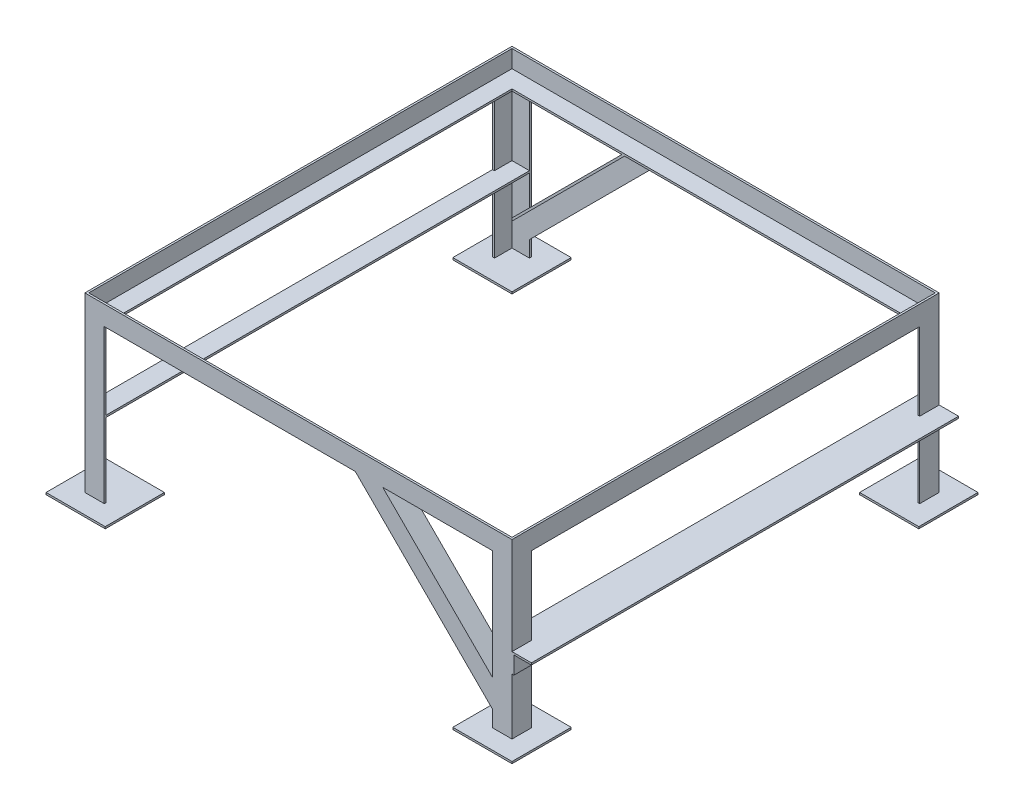
from build123d import *

# Parameters (mm, degrees)
SKETCH_1_W       = 1100
SKETCH_1_H       = 1100
SKETCH_1_W_2     = 1000
SKETCH_1_H_2     = 1000
EXTRUDE_1_DEPTH  = 5
SKETCH_2_W       = 1100
SKETCH_2_H       = 1100
SKETCH_2_W_2     = 1090
SKETCH_2_H_2     = 1090
EXTRUDE_2_DEPTH  = 45
EXTRUDE_3_DEPTH  = 400
SKETCH_4_W       = 152.5
SKETCH_4_H       = 152.5
EXTRUDE_4_DEPTH  = 5
EXTRUDE_6_REACH  = 1355.154
EXTRUDE_7_DEPTH  = 5
EXTRUDE_8_DEPTH  = 45
EXTRUDE_9_DEPTH  = 5
EXTRUDE_10_DEPTH = 45
EXTRUDE_11_DEPTH = 1100


with BuildPart() as part:
    # Эскиз1 → Бобышка-Вытянуть1 (new body)
    with BuildSketch(Plane(origin=(0, 0, 0), x_dir=(1, 0, 0), z_dir=(0, 1, 0))):
        Rectangle(SKETCH_1_W, SKETCH_1_H)
        Rectangle(SKETCH_1_W_2, SKETCH_1_H_2, mode=Mode.SUBTRACT)
    extrude(amount=EXTRUDE_1_DEPTH)

    # Эскиз2 → Бобышка-Вытянуть2 (add)
    with BuildSketch(Plane.XZ.offset(-5)):
        Rectangle(SKETCH_2_W, SKETCH_2_H)
        Rectangle(SKETCH_2_W_2, SKETCH_2_H_2, mode=Mode.SUBTRACT)
    extrude(amount=-EXTRUDE_2_DEPTH)

    # Эскиз3 → Бобышка-Вытянуть3 (add)
    with BuildSketch(Plane.XZ):
        Polygon((550, 550), (500, 550), (500, 545), (545, 545), (545, 500), (550, 500), align=None)
        Polygon((545, -500), (545, -545), (500, -545), (500, -550), (550, -550), (550, -500), align=None)
        Polygon((-550, -550), (-500, -550), (-500, -545), (-545, -545), (-545, -500), (-550, -500), align=None)
        Polygon((-545, 500), (-545, 545), (-500, 545), (-500, 550), (-550, 550), (-550, 500), align=None)
    extrude(amount=EXTRUDE_3_DEPTH)

    # Эскиз4 → Бобышка-Вытянуть4 (add)
    with BuildSketch(Plane.XZ.offset(400)):
        with Locations((523.75, 523.75)):
            Rectangle(SKETCH_4_W, SKETCH_4_H)
        with Locations((523.75, -523.75)):
            Rectangle(SKETCH_4_W, SKETCH_4_H)
        with Locations((-523.75, -523.75)):
            Rectangle(SKETCH_4_W, SKETCH_4_H)
        with Locations((-523.75, 523.75)):
            Rectangle(SKETCH_4_W, SKETCH_4_H)
    extrude(amount=-EXTRUDE_4_DEPTH)

    # Бобышка-Вытянуть6: up to this face of the body (flat: up to its plane)
    extrude_6_end = Plane(part.part.faces().sort_by_distance((522.5, -197.5, 545))[0])
    # Эскиз6 → Бобышка-Вытянуть6 (add, up to the picked face)
    with BuildSketch(Plane.XY.offset(-545), mode=Mode.PRIVATE) as extrude_6_sk1:
        Polygon((500, -200), (550, -200), (550, -250), (545, -250), (545, -205), (500, -205), align=None)
    extrude_6_tool1 = split(extrude(extrude_6_sk1.sketch, amount=EXTRUDE_6_REACH, mode=Mode.PRIVATE), bisect_by=extrude_6_end, keep=Keep.BOTH, mode=Mode.PRIVATE)
    # Эскиз6 → Бобышка-Вытянуть6 (add, up to the picked face)
    with BuildSketch(Plane.XY.offset(-545), mode=Mode.PRIVATE) as extrude_6_sk2:
        Polygon((-545, -250), (-545, -205), (-500, -205), (-500, -200), (-550, -200), (-550, -250), align=None)
    extrude_6_tool2 = split(extrude(extrude_6_sk2.sketch, amount=EXTRUDE_6_REACH, mode=Mode.PRIVATE), bisect_by=extrude_6_end, keep=Keep.BOTH, mode=Mode.PRIVATE)
    add(extrude_6_tool1.solids().sort_by(Axis((525, -200.707107, -545), (0, 0, 1)))[0])
    add(extrude_6_tool2.solids().sort_by(Axis((-545.707107, -227.5, -545), (0, 0, 1)))[0])

    # Эскиз7 → Бобышка-Вытянуть7 (add)
    with BuildSketch(Plane.XY.offset(550)):
        Polygon((146.446609407, 0), (217.157287525, 0), (500, -282.842712475), (500, -353.553390593), align=None)
    extrude(amount=-EXTRUDE_7_DEPTH)

    # Эскиз8 → Бобышка-Вытянуть8 (add)
    with BuildSketch(Plane(origin=(0, 0, 545), x_dir=(-1, 0, 0), z_dir=(0, 0, -1))):
        Polygon((-217.157287525, 0), (-210.086219714, 0), (-500, -289.913780286), (-500, -282.842712475), align=None)
    extrude(amount=EXTRUDE_8_DEPTH)

    # Эскиз9 → Бобышка-Вытянуть9 (add)
    with BuildSketch(Plane(origin=(0, 0, -550), x_dir=(-1, 0, 0), z_dir=(0, 0, -1))):
        Polygon((146.446609407, 0), (500, -353.553390593), (500, -282.842712475), (217.157287525, 0), align=None)
    extrude(amount=-EXTRUDE_9_DEPTH)

    # Эскиз10 → Бобышка-Вытянуть10 (add)
    with BuildSketch(Plane.XY.offset(-545)):
        Polygon((-217.157287525, 0), (-210.086219714, 0), (-500, -289.913780286), (-500, -282.842712475), align=None)
    extrude(amount=EXTRUDE_10_DEPTH)

    # Эскиз11 → Бобышка-Вытянуть11 (add)
    with BuildSketch(Plane.XY.offset(550)):
        Polygon((550, -250), (555, -250), (555, -205), (600, -205), (600, -200), (550, -200), align=None)
    extrude(amount=-EXTRUDE_11_DEPTH)


solid = part.part
